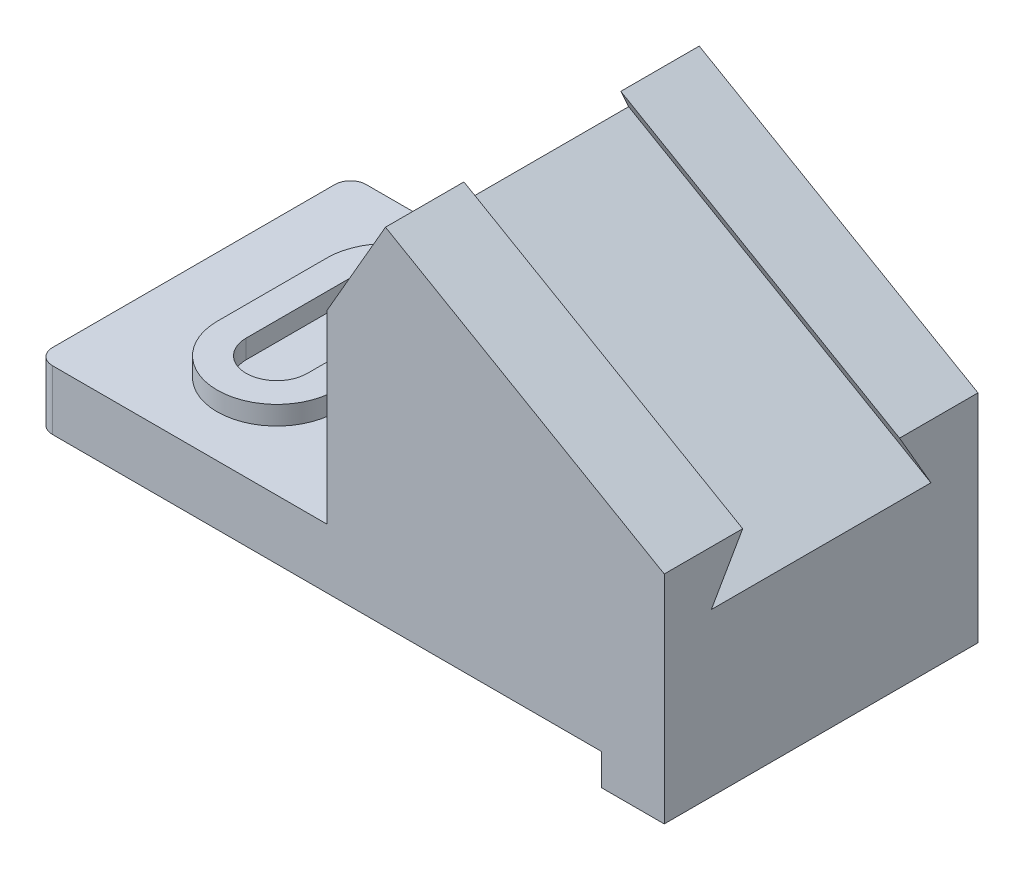
from build123d import *

# Parameters (mm, degrees)
BOSS_EXTRUDE1_DEPTH = 200
CUT_EXTRUDE1_DEPTH  = 466.401952215
FILLET1_R           = 10
BOSS_EXTRUDE2_DEPTH = 12


with BuildPart() as part:
    # Sketch1 → Boss-Extrude1 (new body)
    with BuildSketch(Plane.XY):
        Polygon((0, 0), (360, 0), (360, -20), (400, -20), (400, 118), (222.295517328, 220.597730907), (185, 156), (185, 38), (0, 38), align=None)
    extrude(amount=BOSS_EXTRUDE1_DEPTH)

    # Sketch2 → Cut-Extrude1 (cut, through all)
    with BuildSketch(Plane(origin=(71.200018505, -41.10734985, 0), x_dir=(0, 0, 1), z_dir=(-0.8660254037844399, 0.4999999999999977, 0))):
        Polygon((30, 272.190997647), (170, 272.190997647), (150, 302.190997647), (50, 302.190997647), align=None)
    extrude(amount=-CUT_EXTRUDE1_DEPTH, mode=Mode.SUBTRACT)

    # Fillet1
    fillet1_edges = [part.edges().sort_by_distance(p)[0] for p in [
        (0, 19, 0),
        (0, 19, 200),
    ]]
    fillet(fillet1_edges, radius=FILLET1_R)

    # Sketch3 → Boss-Extrude2 (add)
    with BuildSketch(Plane(origin=(0, 38, 0), x_dir=(1, 0, 0), z_dir=(0, 1, 0))):
        with BuildLine():
            Line((50, -135), (50, -65))
            ThreePointArc((50, -65), (87.999995632, -26.999991264), (126, -64.999991264))
            Line((126, -64.999991264), (126, -135))
            ThreePointArc((126, -135), (88, -173), (50, -135))
        make_face()
        with BuildLine():
            Line((68.5, -135), (68.5, -65))
            ThreePointArc((68.5, -65), (87.999995632, -45.499991264), (107.5, -64.999991264))
            Line((107.5, -64.999991264), (107.5, -135))
            ThreePointArc((107.5, -135), (88, -154.5), (68.5, -135))
        make_face(mode=Mode.SUBTRACT)
    extrude(amount=BOSS_EXTRUDE2_DEPTH)


solid = part.part
